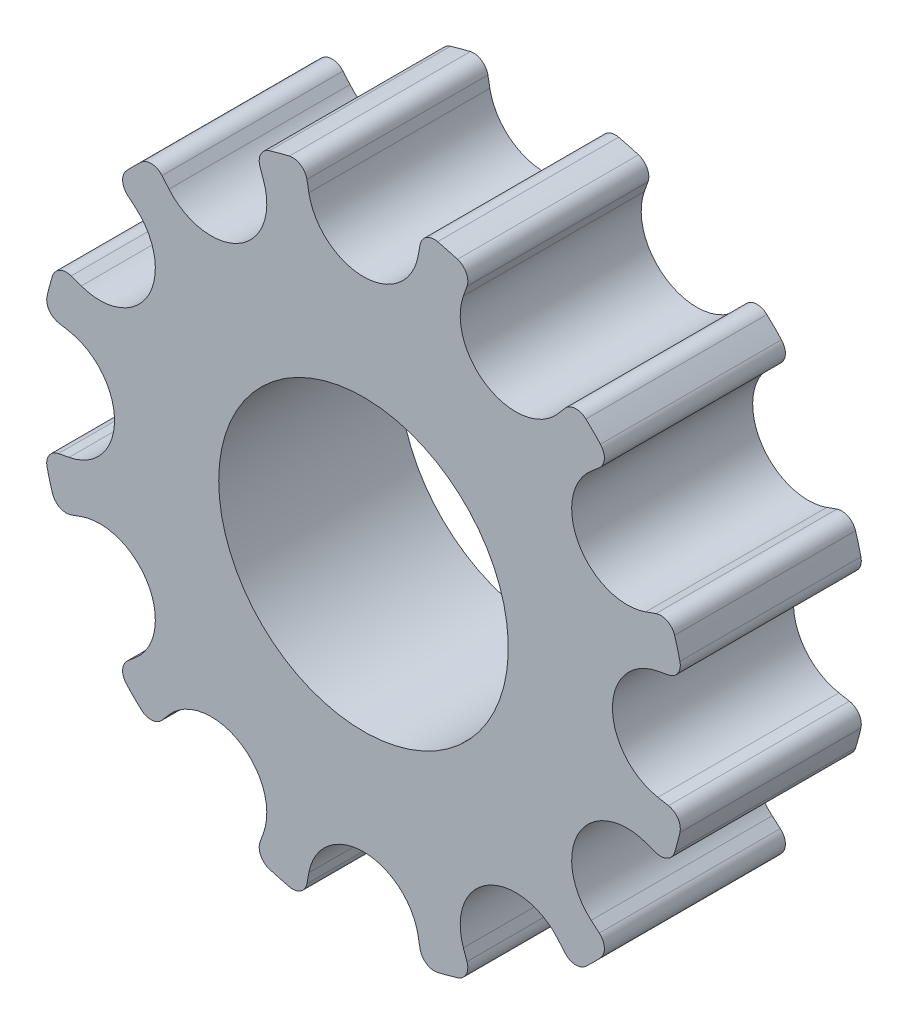
from build123d import *

# Parameters (mm, degrees)
SKETCH_3_R                       = 8.977796586
EXTRUDE_2_DEPTH                  = 2.5
CUT_EXTRUDE_2_DEPTH              = 13.940311552
FILLET_1_R                       = 0.4
PATTERN_CIRCULAR_1_COUNT         = 12
FILLET_1_OF_PATTERN_CIRCULAR_1_R = 0.4
SKETCH_4_R                       = 4
CUT_EXTRUDE_3_DEPTH              = 14.348503998


with BuildPart() as part:
    # 스케치3 → 보스-돌출2 (new, symmetric)
    with BuildSketch(Plane.XY):
        Circle(SKETCH_3_R)
    extrude(amount=EXTRUDE_2_DEPTH, both=True)

    # 스케치3<3> → 컷-돌출2 (cut, symmetric)
    with BuildSketch(Plane.XY):
        with BuildLine():
            Line((-1.638089976, 8.827088578), (-1.509232342, 8.132720278))
            ThreePointArc((-1.509232342, 8.132720278), (0, 6.877796586), (1.509232342, 8.132720278))
            Line((1.509232342, 8.132720278), (1.638089976, 8.827088578))
            ThreePointArc((1.638089976, 8.827088578), (0, 8.977796586), (-1.638089976, 8.827088578))
        make_face()
    cut_extrude_2 = extrude(amount=CUT_EXTRUDE_2_DEPTH, both=True, mode=Mode.SUBTRACT)

    # 필렛1
    fillet_1_edges = [part.edges().sort_by_distance(p)[0] for p in [
        (1.638089976, 8.827088578, 0),
        (-1.638089976, 8.827088578, 0),
    ]]
    fillet(fillet_1_edges, radius=FILLET_1_R)

    # 원형 패턴1: 컷-돌출2 ×12 about axis
    pattern_circular_1_axis = Axis((0, 0, 2.5), (0, 0, -1))
    for i in range(1, PATTERN_CIRCULAR_1_COUNT):
        add(cut_extrude_2.rotate(pattern_circular_1_axis, i * 360 / PATTERN_CIRCULAR_1_COUNT), mode=Mode.SUBTRACT)

    # 필렛1 of 원형 패턴1
    fillet_1_of_pattern_circular_1_edges = [part.edges().sort_by_distance(p)[0] for p in [
        (5.832171822, 6.825437962, 0),
        (2.994916756, 8.463527938, 0),
        (8.463527938, 2.994916756, 0),
        (6.825437962, 5.832171822, 0),
        (8.827088578, -1.638089976, 0),
        (8.827088578, 1.638089976, 0),
        (6.825437962, -5.832171822, 0),
        (8.463527938, -2.994916756, 0),
        (2.994916756, -8.463527938, 0),
        (5.832171822, -6.825437962, 0),
        (-1.638089976, -8.827088578, 0),
        (1.638089976, -8.827088578, 0),
        (-5.832171822, -6.825437962, 0),
        (-2.994916756, -8.463527938, 0),
        (-8.463527938, -2.994916756, 0),
        (-6.825437962, -5.832171822, 0),
        (-8.827088578, 1.638089976, 0),
        (-8.827088578, -1.638089976, 0),
        (-6.825437962, 5.832171822, 0),
        (-8.463527938, 2.994916756, 0),
        (-2.994916756, 8.463527938, 0),
        (-5.832171822, 6.825437962, 0),
    ]]
    fillet(fillet_1_of_pattern_circular_1_edges, radius=FILLET_1_OF_PATTERN_CIRCULAR_1_R)

    # 스케치4 → 컷-돌출3 (cut, through all)
    with BuildSketch(Plane(origin=(0, 0, -2.5), x_dir=(-1, 0, 0), z_dir=(0, 0, -1))):
        Circle(SKETCH_4_R)
    extrude(amount=-CUT_EXTRUDE_3_DEPTH, mode=Mode.SUBTRACT)


solid = part.part
